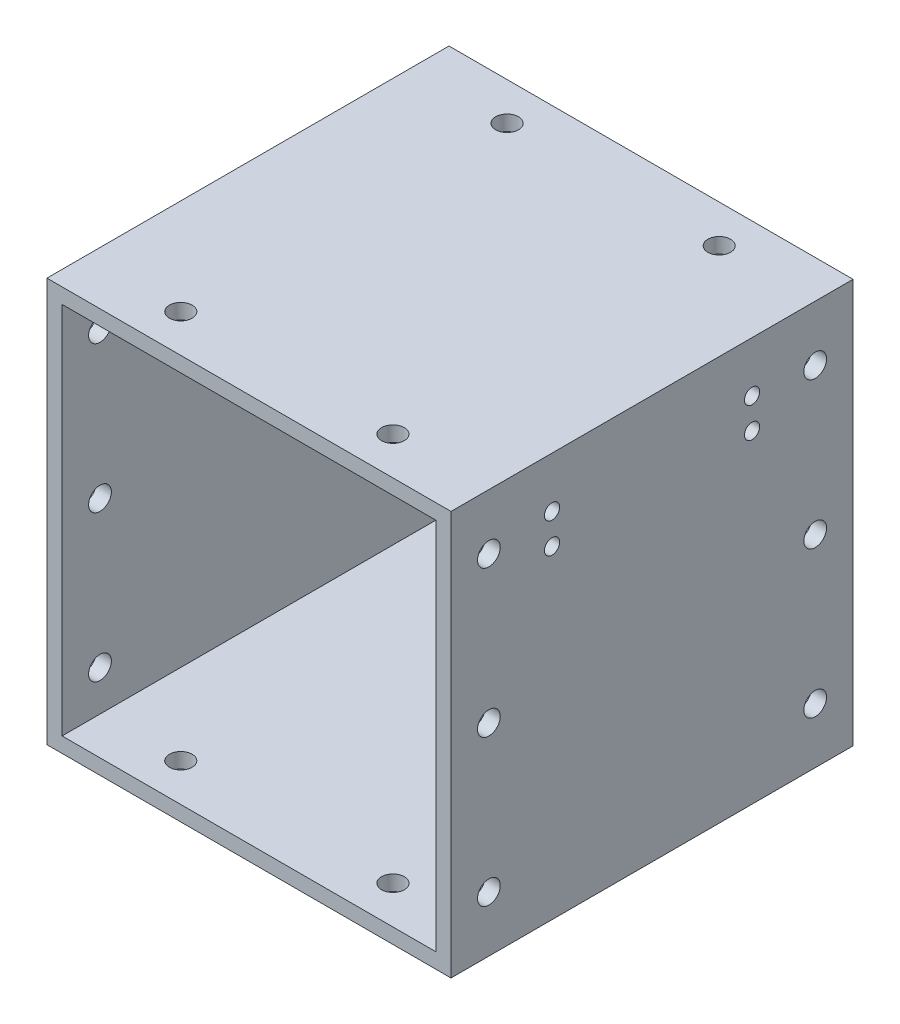
from build123d import *

# Parameters (mm, degrees)
SKETCH1_W                      = 80
SKETCH1_H                      = 80
SKETCH1_W_2                    = 74
SKETCH1_H_2                    = 74
BOSS_EXTRUDE1_DEPTH            = 79.6
M4_CLEARANCE_HOLE1_D           = 4.5
M4_CLEARANCE_HOLE1_ON_FACE_2_D = 4.5
M4_CLEARANCE_HOLE1_ON_FACE_3_D = 4.5
M4_CLEARANCE_HOLE1_ON_FACE_4_D = 4.5
F_3_0_3_DIAMETER_HOLE1_D       = 3
F_3_0_3_DIAMETER_HOLE1_DEPTH   = 3


with BuildPart() as part:
    # Sketch1 → Boss-Extrude1 (new body)
    with BuildSketch(Plane.XY.offset(57)):
        Rectangle(SKETCH1_W, SKETCH1_H)
        Rectangle(SKETCH1_W_2, SKETCH1_H_2, mode=Mode.SUBTRACT)
    extrude(amount=BOSS_EXTRUDE1_DEPTH)

    # M4 Clearance Hole1 (through all)
    with Locations(Plane(origin=(40, 29, 64.5), x_dir=(0, 0, 1), z_dir=(1, 0, 0))):
        with Locations((0, 0), (0, 58), (0, 29), (64.6, 0), (64.6, 29), (64.6, 58)):
            Hole(M4_CLEARANCE_HOLE1_D / 2)

    # M4 Clearance Hole1 on face 2 (through all)
    with Locations(Plane(origin=(21, 40, 64.5), x_dir=(0, 0, 1), z_dir=(0, 1, 0))):
        with Locations((0, 0), (0, -42), (64.6, -42), (64.6, 0)):
            Hole(M4_CLEARANCE_HOLE1_ON_FACE_2_D / 2)

    # M4 Clearance Hole1 on face 3 (through all)
    with Locations(Plane(origin=(-40, 29, 64.5), x_dir=(0, 0, -1), z_dir=(-1, 0, 0))):
        with Locations((0, 0), (0, 29), (0, 58), (-64.6, 58), (-64.6, 29), (-64.6, 0)):
            Hole(M4_CLEARANCE_HOLE1_ON_FACE_3_D / 2)

    # M4 Clearance Hole1 on face 4 (through all)
    with Locations(Plane(origin=(21, -40, 64.5), x_dir=(0, 0, -1), z_dir=(0, -1, 0))):
        with Locations((0, 0), (0, -42), (-64.6, -42), (-64.6, 0)):
            Hole(M4_CLEARANCE_HOLE1_ON_FACE_4_D / 2)

    # Ø3.0 (3) Diameter Hole1
    with Locations(Plane(origin=(40, 0, 0), x_dir=(0, 0, -1), z_dir=(1, 0, 0))):
        with Locations((-77, 30), (-116.6, 24), (-116.6, 30), (-77, 24)):
            Hole(F_3_0_3_DIAMETER_HOLE1_D / 2, depth=F_3_0_3_DIAMETER_HOLE1_DEPTH)


solid = part.part
